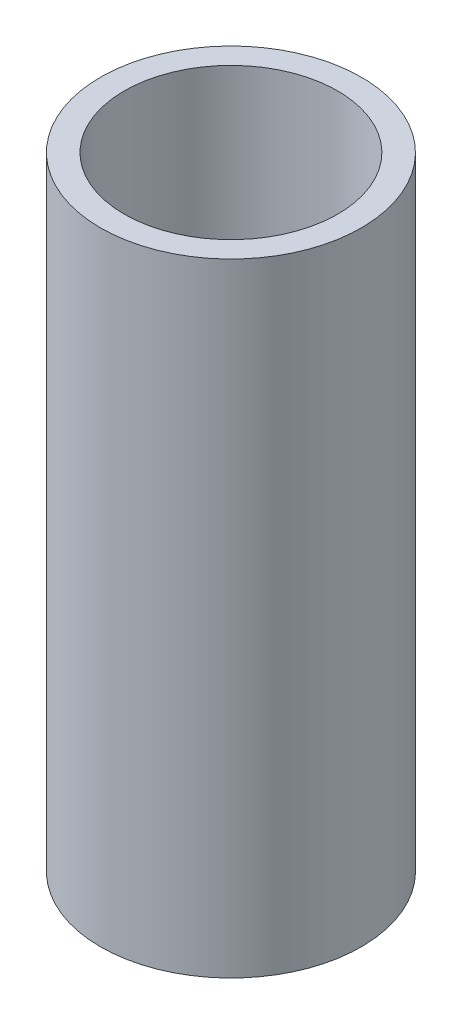
from build123d import *

# Parameters (mm, degrees)
SKETCH1_R           = 2.0955
SKETCH1_R_2         = 1.7145
BOSS_EXTRUDE1_DEPTH = 10


with BuildPart() as part:
    # Sketch1 → Boss-Extrude1 (new body)
    with BuildSketch(Plane(origin=(0, 0, 0), x_dir=(1, 0, 0), z_dir=(0, 1, 0))):
        with Locations(Location((0, 0, 0), (0, 0, 270))):
            Circle(SKETCH1_R)
        with Locations(Location((0, 0, 0), (0, 0, 270))):
            Circle(SKETCH1_R_2, mode=Mode.SUBTRACT)
    extrude(amount=BOSS_EXTRUDE1_DEPTH)


solid = part.part
